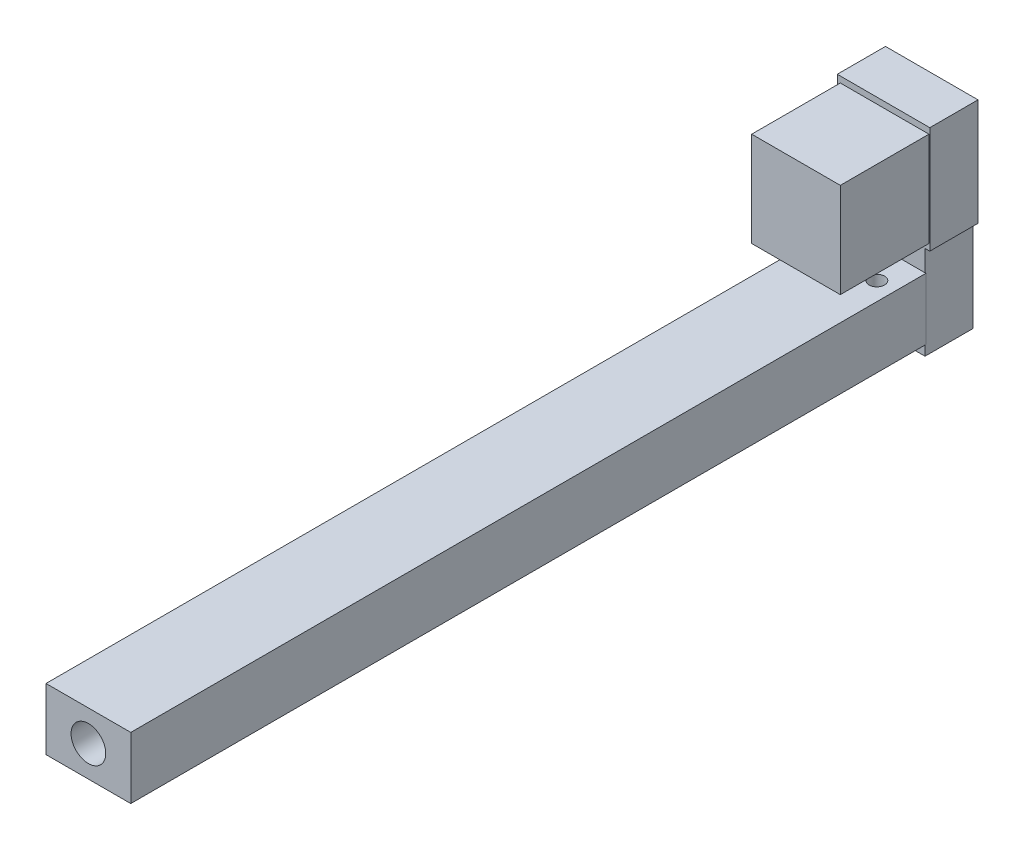
from build123d import *

# Parameters (mm, degrees)
SKETCH1_W               = 1310.386
SKETCH1_H               = 101.6
BOSS_EXTRUDE1_DEPTH     = 69.85
BOSS_EXTRUDE2_DEPTH     = 68.326
SKETCH3_W               = 79.430838384
SKETCH3_H               = 176.27
BOSS_EXTRUDE3_DEPTH     = 76.23
SKETCH4_W               = 146.04
SKETCH4_H               = 156.04
BOSS_EXTRUDE4_DEPTH     = 146.05
SKETCH5_R               = 28.575
CUT_EXTRUDE1_DEPTH      = 927.1
CUT_EXTRUDE2_DEPTH      = 10
CUT_EXTRUDE2_DEPTH_BACK = 1330.46311815
SKETCH6_R               = 12.7


with BuildPart() as part:
    # Sketch1 → Boss-Extrude1 (new, symmetric)
    with BuildSketch(Plane(origin=(0, 0, 0), x_dir=(0, 0, -1), z_dir=(1, 0, 0))):
        with Locations((-655.193, 0)):
            Rectangle(SKETCH1_W, SKETCH1_H)
    extrude(amount=BOSS_EXTRUDE1_DEPTH, both=True)

    # Sketch2 → Boss-Extrude2 (add, symmetric)
    with BuildSketch(Plane(origin=(0, 0, 0), x_dir=(0, 0, -1), z_dir=(1, 0, 0))):
        Polygon((0, 0), (0, -68.326), (79.430838384, -68.326), (79.430838384, 85.598), (0, 85.598), align=None)
    extrude(amount=BOSS_EXTRUDE2_DEPTH, both=True)

    # Sketch3 → Boss-Extrude3 (add, symmetric)
    with BuildSketch(Plane(origin=(0, 0, 0), x_dir=(0, 0, -1), z_dir=(1, 0, 0))):
        with Locations((39.715419192, 173.733)):
            Rectangle(SKETCH3_W, SKETCH3_H)
    extrude(amount=BOSS_EXTRUDE3_DEPTH, both=True)

    # Sketch4 → Boss-Extrude4 (add)
    with BuildSketch(Plane.XY):
        with Locations((1.79, 173.848)):
            Rectangle(SKETCH4_W, SKETCH4_H)
    extrude(amount=BOSS_EXTRUDE4_DEPTH)

    # Sketch5 → Cut-Extrude1 (cut)
    with BuildSketch(Plane.XY.offset(1310.386)):
        Circle(SKETCH5_R)
    extrude(amount=-CUT_EXTRUDE1_DEPTH, mode=Mode.SUBTRACT)

    # Sketch6 → Cut-Extrude2 (cut, two sides: drawn at the far end of the back side and taken through both)
    with BuildSketch(Plane(origin=(0, 50.8, 0), x_dir=(1, 0, 0), z_dir=(0, 1, 0)).offset(-CUT_EXTRUDE2_DEPTH_BACK)):
        with Locations(Location((39.81, -50.8, 0), (0, 0, 270))):
            Circle(SKETCH6_R)
    extrude(amount=CUT_EXTRUDE2_DEPTH + CUT_EXTRUDE2_DEPTH_BACK, mode=Mode.SUBTRACT)


solid = part.part
